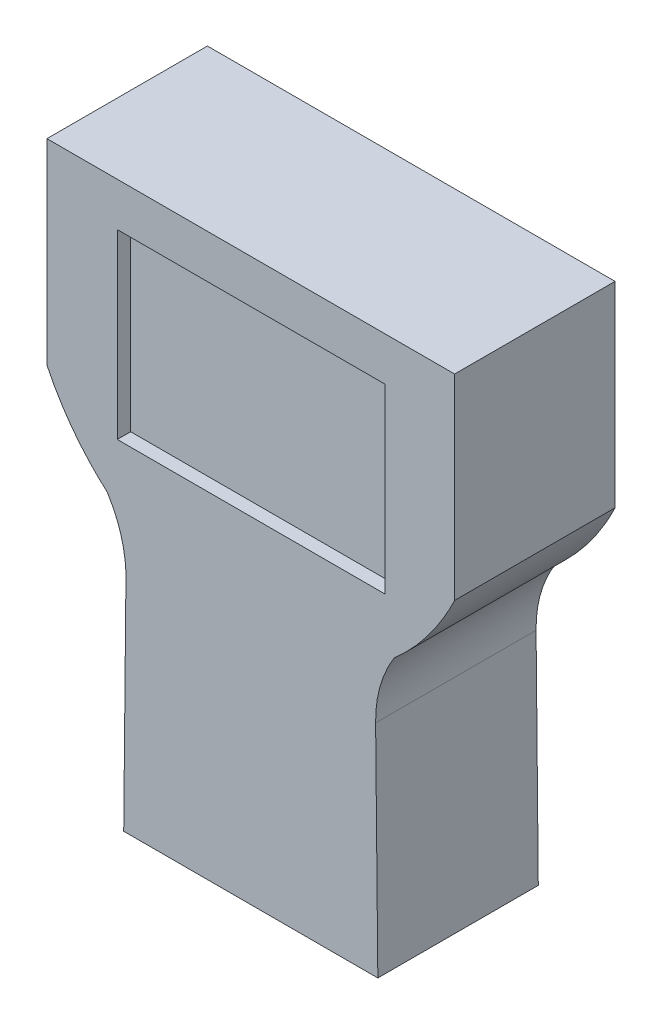
from build123d import *

# Parameters (mm, degrees)
BOSS_EXTRUDE1_DEPTH = 30
SKETCH2_W           = 50.095183997
SKETCH2_H           = 33.986838613
CUT_EXTRUDE1_DEPTH  = 2.5


with BuildPart() as part:
    # Sketch1 → Boss-Extrude1 (new body)
    with BuildSketch(Plane.XY):
        with BuildLine():
            Line((31.309465796, -34.490317077), (31.723853575, -75.590275849))
            Line((31.723853575, -75.590275849), (-15.789641544, -75.590275849))
            Line((-15.789641544, -75.590275849), (-15.375253765, -34.490317077))
            add(Edge.make_bspline(
                [(-18.877545921, -22.198221739), (-16.498314262, -25.992208525), (-15.330883543, -30.089573637), (-15.375253765, -34.490317077)],
                knots=[0, 0, 0, 0, 1, 1, 1, 1], degree=3))
            add(Edge.make_bspline(
                [(-30.14454169, -7.27706518), (-25.994179114, -15.945334243), (-18.877545921, -22.198221739)],
                knots=[0, 0, 0, 1, 1, 1], degree=2))
            Line((-30.14454169, -7.27706518), (-30.14454169, 29.385543018))
            Line((-30.14454169, 29.385543018), (25.046286628, 29.385543018))
            Line((25.046286628, 29.385543018), (46.078753721, 29.385543018))
            Line((46.078753721, 29.385543018), (46.078753721, -7.27706518))
            add(Edge.make_bspline(
                [(46.078753721, -7.27706518), (41.928391145, -15.945334243), (34.811757952, -22.198221739)],
                knots=[0, 0, 0, 1, 1, 1], degree=2))
            add(Edge.make_bspline(
                [(34.811757952, -22.198221739), (32.432526292, -25.992208525), (31.265095574, -30.089573637), (31.309465796, -34.490317077)],
                knots=[0, 0, 0, 0, 1, 1, 1, 1], degree=3))
        make_face()
    extrude(amount=BOSS_EXTRUDE1_DEPTH)

    # Sketch2 → Cut-Extrude1 (cut)
    with BuildSketch(Plane.XY.offset(30)):
        with Locations((8.055613407, 4.246417782)):
            Rectangle(SKETCH2_W, SKETCH2_H)
    extrude(amount=-CUT_EXTRUDE1_DEPTH, mode=Mode.SUBTRACT)


solid = part.part
